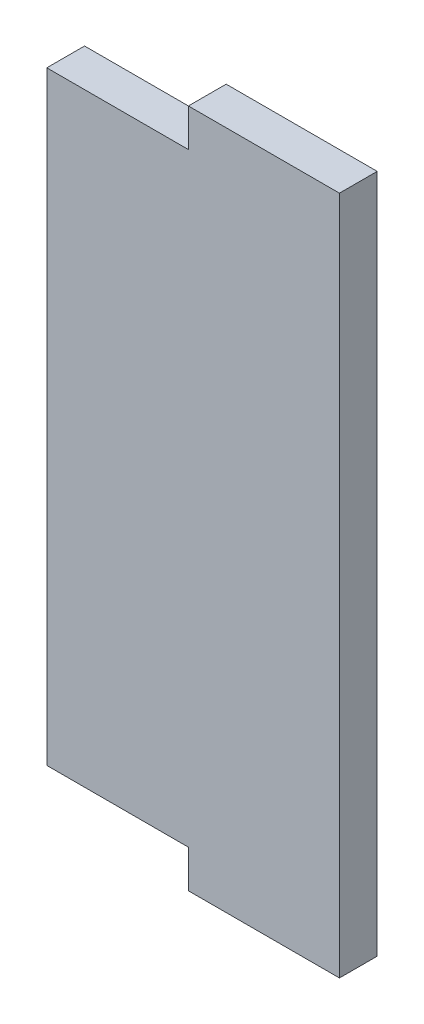
from build123d import *

# Parameters (mm, degrees)
BOSS_EXTRUDE1_DEPTH = 3.175


with BuildPart() as part:
    # Sketch1 → Boss-Extrude1 (new body)
    with BuildSketch(Plane.XY):
        Polygon((60.325, -3.175), (47.625, -3.175), (47.625, 0), (35.71875, 0), (35.71875, 50.8), (47.625, 50.8), (47.625, 53.975), (60.325, 53.975), align=None)
    extrude(amount=BOSS_EXTRUDE1_DEPTH)


solid = part.part
